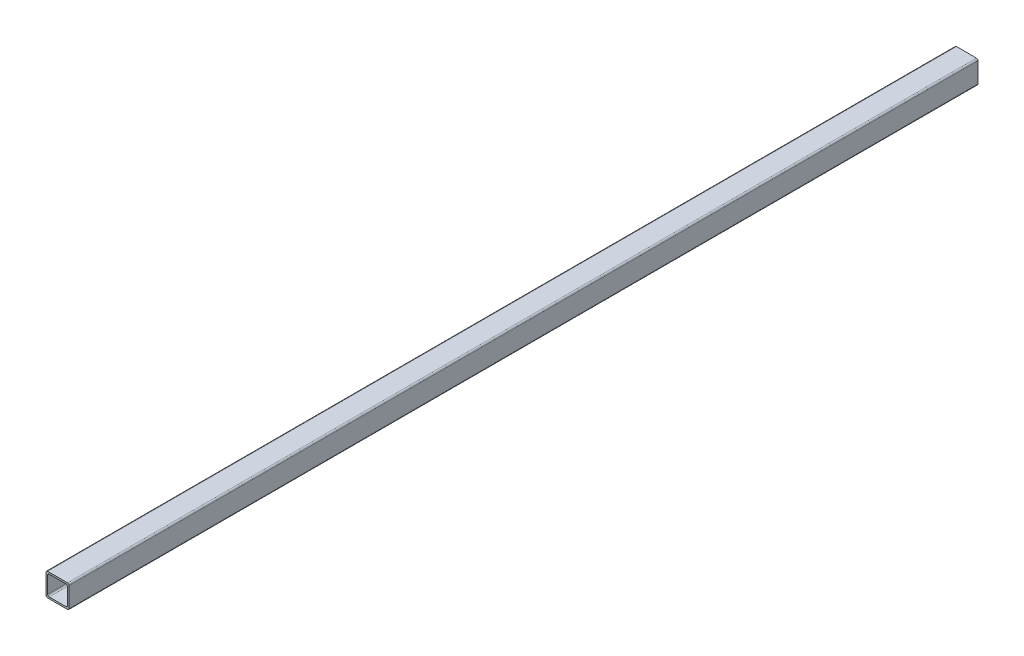
from build123d import *

# Parameters (mm, degrees)
BOSS_EXTRUDE1_DEPTH = 1500


with BuildPart() as part:
    # Sketch1 → Boss-Extrude1 (new body)
    with BuildSketch(Plane.XY):
        with BuildLine():
            Line((2.54, 0), (35.56, 0))
            ThreePointArc((35.56, 0), (37.356051224, -0.743948776), (38.1, -2.54))
            Line((38.1, -2.54), (38.1, -35.56))
            ThreePointArc((38.1, -35.56), (37.356051224, -37.356051224), (35.56, -38.1))
            Line((35.56, -38.1), (2.54, -38.1))
            ThreePointArc((2.54, -38.1), (0.743948776, -37.356051224), (0, -35.56))
            Line((0, -35.56), (0, -2.54))
            ThreePointArc((0, -2.54), (0.743948776, -0.743948776), (2.54, 0))
        make_face()
        with BuildLine():
            Line((5.3086, -2.7686), (32.7914, -2.7686))
            ThreePointArc((32.7914, -2.7686), (34.587451224, -3.512548776), (35.3314, -5.3086))
            Line((35.3314, -5.3086), (35.3314, -32.7914))
            ThreePointArc((35.3314, -32.7914), (34.587451224, -34.587451224), (32.7914, -35.3314))
            Line((32.7914, -35.3314), (5.3086, -35.3314))
            ThreePointArc((5.3086, -35.3314), (3.512548776, -34.587451224), (2.7686, -32.7914))
            Line((2.7686, -32.7914), (2.7686, -5.3086))
            ThreePointArc((2.7686, -5.3086), (3.512548776, -3.512548776), (5.3086, -2.7686))
        make_face(mode=Mode.SUBTRACT)
    extrude(amount=BOSS_EXTRUDE1_DEPTH)


solid = part.part
